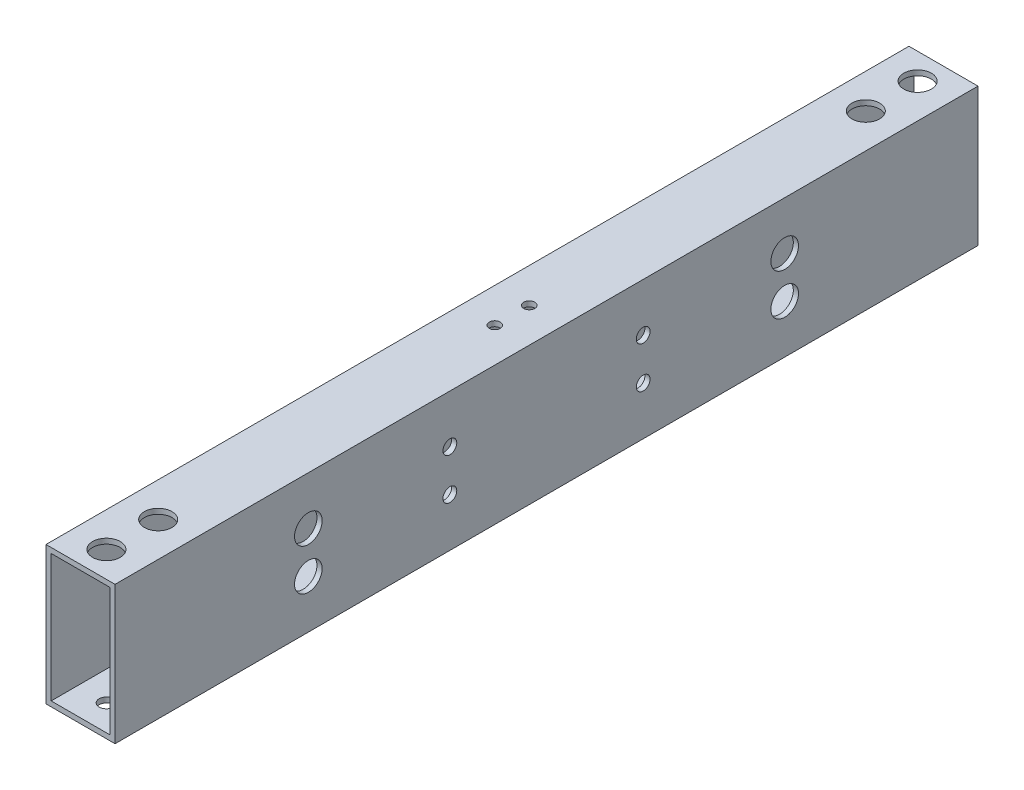
from build123d import *

# Parameters (mm, degrees)
SKETCH_1_W          = 20
SKETCH_1_H          = 40
SKETCH_1_W_2        = 17
SKETCH_1_H_2        = 37
EXTRUDE_1_DEPTH     = 250
SKETCH_2_R          = 2
CUT_EXTRUDE_1_DEPTH = 252.594912508
SKETCH_3_R          = 2.1
CUT_EXTRUDE_2_DEPTH = 254.377189186
SKETCH_4_R          = 1.6
CUT_EXTRUDE_3_DEPTH = 254.377189186
SKETCH_5_R          = 4
CUT_EXTRUDE_4_DEPTH = 10
SKETCH_6_R          = 4
CUT_EXTRUDE_5_DEPTH = 10


with BuildPart() as part:
    # 草图1 → 凸台-拉伸1 (new body)
    with BuildSketch(Plane.XY):
        Rectangle(SKETCH_1_W, SKETCH_1_H)
        Rectangle(SKETCH_1_W_2, SKETCH_1_H_2, mode=Mode.SUBTRACT)
    extrude(amount=-EXTRUDE_1_DEPTH)

    # 草图2 → 切除-拉伸1 (cut, through all)
    with BuildSketch(Plane.ZY.offset(10)):
        with Locations((-97, 6)):
            Circle(SKETCH_2_R)
        with Locations((-56, 6)):
            Circle(SKETCH_2_R)
        with Locations((-56, -6)):
            Circle(SKETCH_2_R)
        with Locations((-97, -6)):
            Circle(SKETCH_2_R)
        with Locations((-153, -6)):
            Circle(SKETCH_2_R)
        with Locations((-194, -6)):
            Circle(SKETCH_2_R)
        with Locations((-194, 6)):
            Circle(SKETCH_2_R)
        with Locations((-153, 6)):
            Circle(SKETCH_2_R)
    extrude(amount=-CUT_EXTRUDE_1_DEPTH, mode=Mode.SUBTRACT)

    # 草图3 → 切除-拉伸2 (cut, through all)
    with BuildSketch(Plane(origin=(0, 20, 0), x_dir=(1, 0, 0), z_dir=(0, 1, 0))):
        with Locations(Location((0, 22.5, 0), (0, 0, 270))):
            Circle(SKETCH_3_R)
        with Locations(Location((0, 7.5, 0), (0, 0, 270))):
            Circle(SKETCH_3_R)
        with Locations(Location((0, 242.5, 0), (0, 0, 270))):
            Circle(SKETCH_3_R)
        with Locations(Location((0, 227.5, 0), (0, 0, 270))):
            Circle(SKETCH_3_R)
    extrude(amount=-CUT_EXTRUDE_2_DEPTH, mode=Mode.SUBTRACT)

    # 草图4 → 切除-拉伸3 (cut, through all)
    with BuildSketch(Plane(origin=(0, 20, 0), x_dir=(1, 0, 0), z_dir=(0, 1, 0))):
        with Locations(Location((0, 130, 0), (0, 0, 270))):
            Circle(SKETCH_4_R)
        with Locations(Location((0, 120, 0), (0, 0, 270))):
            Circle(SKETCH_4_R)
    extrude(amount=-CUT_EXTRUDE_3_DEPTH, mode=Mode.SUBTRACT)

    # 草图5 → 切除-拉伸4 (cut)
    with BuildSketch(Plane(origin=(0, 20, 0), x_dir=(1, 0, 0), z_dir=(0, 1, 0))):
        with Locations(Location((0, 22.5, 0), (0, 0, 270))):
            Circle(SKETCH_5_R)
        with Locations(Location((0, 7.5, 0), (0, 0, 270))):
            Circle(SKETCH_5_R)
        with Locations(Location((0, 242.5, 0), (0, 0, 270))):
            Circle(SKETCH_5_R)
        with Locations(Location((0, 227.5, 0), (0, 0, 270))):
            Circle(SKETCH_5_R)
    extrude(amount=-CUT_EXTRUDE_4_DEPTH, mode=Mode.SUBTRACT)

    # 草图6 → 切除-拉伸5 (cut)
    with BuildSketch(Plane(origin=(10, 0, 0), x_dir=(0, 0, -1), z_dir=(1, 0, 0))):
        with Locations((56, 6)):
            Circle(SKETCH_6_R)
        with Locations((56, -6)):
            Circle(SKETCH_6_R)
        with Locations((194, 6)):
            Circle(SKETCH_6_R)
        with Locations((194, -6)):
            Circle(SKETCH_6_R)
    extrude(amount=-CUT_EXTRUDE_5_DEPTH, mode=Mode.SUBTRACT)


solid = part.part
